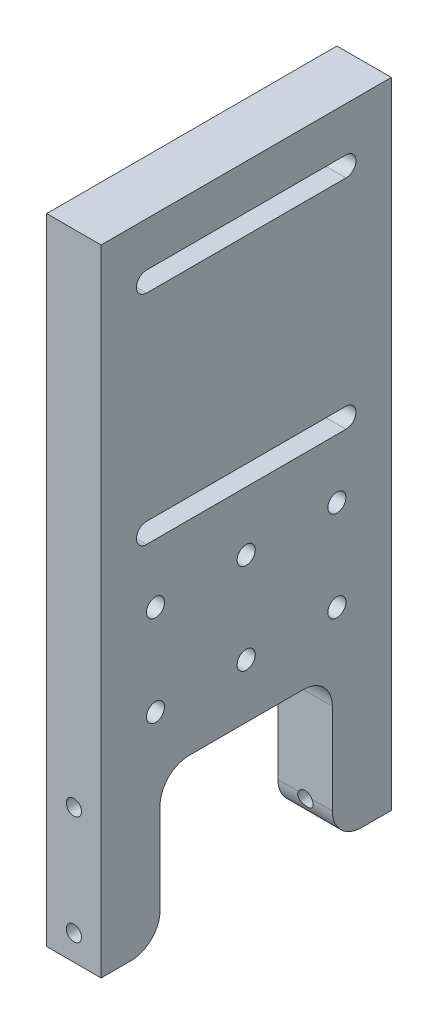
from build123d import *

# Parameters (mm, degrees)
ESQUISSE1_W                   = 15
ESQUISSE1_H                   = 90
BOSS_EXTRU_1_DEPTH            = 80
ESQUISSE2_W                   = 47.5
ESQUISSE2_H                   = 41
ENL_V_MAT_EXTRU_1_DEPTH       = 115.38963181
CONG_1_R                      = 8
ESQUISSE3_W                   = 80
ESQUISSE3_H                   = 85
BOSS_EXTRU_2_DEPTH            = 15
TROU_TARAUD_M5X0_81_D         = 4.2
TROU_TARAUD_PROFOND_M6X1_01_D = 5
R_P_TITION_LIN_AIRE1_COUNT    = 2
R_P_TITION_LIN_AIRE1_PITCH    = 25


with BuildPart() as part:
    # Esquisse1 → Boss.-Extru.1 (new body)
    with BuildSketch(Plane.XY):
        with Locations((37.299465669, 35.374049703)):
            Rectangle(ESQUISSE1_W, ESQUISSE1_H)
    extrude(amount=BOSS_EXTRU_1_DEPTH)

    # Esquisse2 → Enlèv. mat.-Extru.1 (cut, through all)
    with BuildSketch(Plane(origin=(44.799465669, 0, 0), x_dir=(0, 0, -1), z_dir=(1, 0, 0))):
        with Locations((-40, 10.874049703)):
            Rectangle(ESQUISSE2_W, ESQUISSE2_H)
    extrude(amount=-ENL_V_MAT_EXTRU_1_DEPTH, mode=Mode.SUBTRACT)

    # Congé1
    cong_1_edges = [part.edges().sort_by_distance(p)[0] for p in [
        (37.299465669, -9.625950297, 63.75),
        (37.299465669, 31.374049703, 63.75),
        (37.299465669, 31.374049703, 16.25),
        (37.299465669, -9.625950297, 16.25),
    ]]
    fillet(cong_1_edges, radius=CONG_1_R)

    # Esquisse3 → Boss.-Extru.2 (add)
    with BuildSketch(Plane.ZY.offset(-29.799465669)):
        with Locations((40, 122.874049703)):
            Rectangle(ESQUISSE3_W, ESQUISSE3_H)
        with BuildLine():
            Line((12.5, 93.124049703), (67.5, 93.124049703))
            ThreePointArc((67.5, 93.124049703), (70.25, 90.374049703), (67.5, 87.624049703))
            Line((67.5, 87.624049703), (12.5, 87.624049703))
            ThreePointArc((12.5, 87.624049703), (9.75, 90.374049703), (12.5, 93.124049703))
        make_face(mode=Mode.SUBTRACT)
        with BuildLine():
            Line((12.5, 153.124049703), (67.5, 153.124049703))
            ThreePointArc((67.5, 153.124049703), (70.25, 150.374049703), (67.5, 147.624049703))
            Line((67.5, 147.624049703), (12.5, 147.624049703))
            ThreePointArc((12.5, 147.624049703), (9.75, 150.374049703), (12.5, 153.124049703))
        make_face(mode=Mode.SUBTRACT)
    extrude(amount=-BOSS_EXTRU_2_DEPTH)

    # Trou taraudé M5x0.81 (through all)
    with Locations(Plane(origin=(37.299465669, -2.625950297, 80), x_dir=(1, 0, 0), z_dir=(0, 0, 1))):
        with Locations((0, 0), (0, 30)):
            trou_taraud_m5x0_81 = Hole(TROU_TARAUD_M5X0_81_D / 2)

    # Symétrie1: Trou taraudé M5x0.81 across plane
    add(trou_taraud_m5x0_81.mirror(Plane.XY.offset(40)), mode=Mode.SUBTRACT)

    # Trou taraudé profond M6x1.01 (through all)
    with Locations(Plane(origin=(29.799465669, 46.374049703, 15), x_dir=(0, -1, 0), z_dir=(-1, 0, 0))):
        with Locations((0, 0), (0, 25), (0, 50)):
            trou_taraud_profond_m6x1_01 = Hole(TROU_TARAUD_PROFOND_M6X1_01_D / 2)

    # Répétition linéaire1: Trou taraudé profond M6x1.01 ×2
    with Locations(*[(0, i * R_P_TITION_LIN_AIRE1_PITCH, 0) for i in range(1, R_P_TITION_LIN_AIRE1_COUNT)]):
        add(trou_taraud_profond_m6x1_01, mode=Mode.SUBTRACT)


solid = part.part
